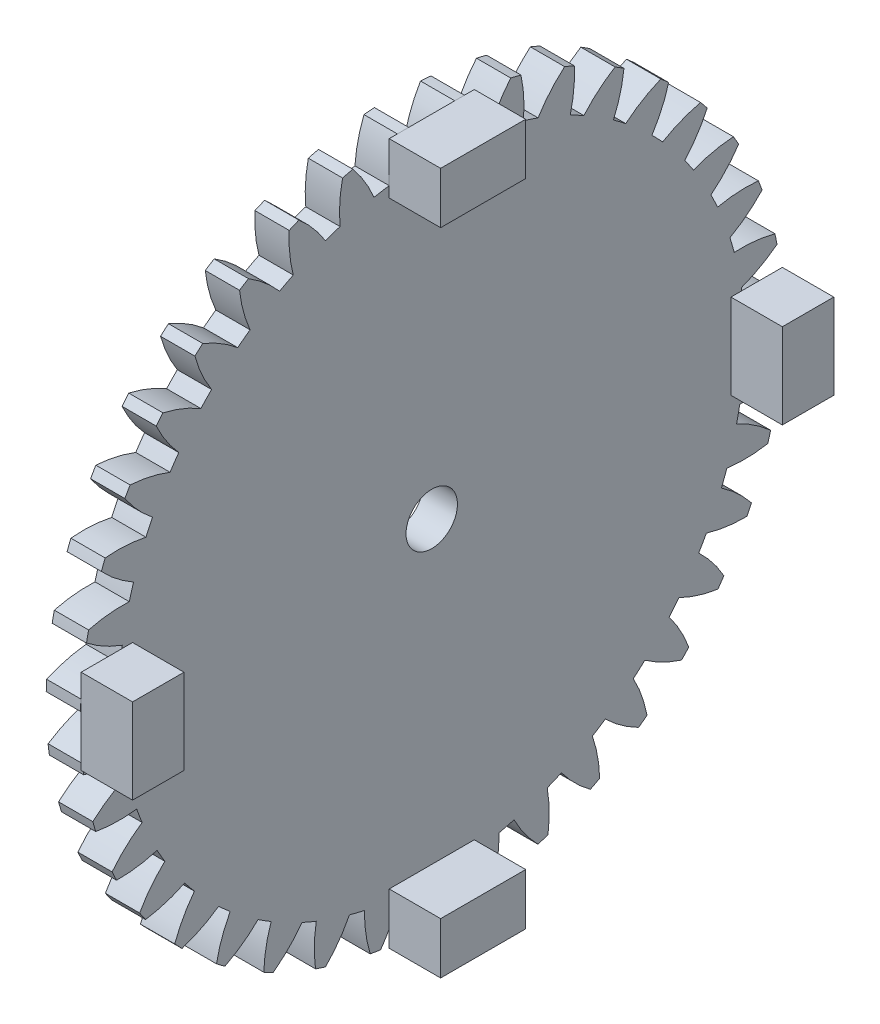
from build123d import *

# Parameters (mm, degrees)
BASPROSKE_W             = 2
BASPROSKE_H             = 20.5
TOOTHCUT_DEPTH          = 30.060282173
TEETHCUTS_COUNT         = 39
TEETHCUTS_ANGLE         = 350.769230769
BORSKE_R                = 1.5
BORE_DEPTH              = 50.0000508
CROQUIS1_W              = 3
CROQUIS1_H              = 4.964439366
CROQUIS1_W_2            = 4.964439366
CROQUIS1_H_2            = 3
SALIENTE_EXTRUIR1_DEPTH = 3


with BuildPart() as part:
    # BasProSke → Base-Revolve (revolve)
    with BuildSketch(Plane(origin=(0, 0, 0), x_dir=(1, 0, 0), z_dir=(0, 1, 0)), mode=Mode.PRIVATE) as base_revolve_sk:
        with Locations((1, 10.25)):
            Rectangle(BASPROSKE_W, BASPROSKE_H)
    revolve(base_revolve_sk.sketch.rotate(Axis((-10, 0, 0), (1, 0, 0)), 180), axis=Axis((-10, 0, 0), (1, 0, 0)))

    # TooCutSke → ToothCut (cut, through all)
    with BuildSketch(Plane(origin=(0, 0, 0), x_dir=(0, 0, -1), z_dir=(1, 0, 0))):
        with BuildLine():
            ThreePointArc((0.450063598, 18.243449338), (0, 18.249), (-0.450063598, 18.243449338))
            ThreePointArc((-0.450063598, 18.243449338), (-0.816963734, 19.397278425), (-1.358007102, 20.480426311))
            ThreePointArc((-1.358007102, 20.480426311), (0, 20.5254), (1.358007102, 20.480426311))
            ThreePointArc((1.358007102, 20.480426311), (0.816963734, 19.397278425), (0.450063598, 18.243449338))
        make_face()
    toothcut = extrude(amount=TOOTHCUT_DEPTH, mode=Mode.SUBTRACT)

    # TeethCuts: ToothCut ×39 about axis
    teethcuts_axis = Axis((-10, 0, 0), (1, 0, 0))
    for i in range(1, TEETHCUTS_COUNT):
        add(toothcut.rotate(teethcuts_axis, i * TEETHCUTS_ANGLE / (TEETHCUTS_COUNT - 1)), mode=Mode.SUBTRACT)

    # BorSke → Bore (cut, symmetric)
    with BuildSketch(Plane(origin=(0, 0, 0), x_dir=(0, 0, -1), z_dir=(1, 0, 0))):
        with Locations(Location((0, 0, 0), (0, 0, 180))):
            Circle(BORSKE_R)
    extrude(amount=BORE_DEPTH, both=True, mode=Mode.SUBTRACT)

    # Croquis1 → Saliente-Extruir1 (add)
    with BuildSketch(Plane(origin=(2, 0, 0), x_dir=(0, 0, -1), z_dir=(1, 0, 0))):
        with Locations((18.955937795, 0)):
            Rectangle(CROQUIS1_W, CROQUIS1_H)
        with Locations((0, 18.955937795)):
            Rectangle(CROQUIS1_W_2, CROQUIS1_H_2)
        with Locations((0, -18.955937795)):
            Rectangle(CROQUIS1_W_2, CROQUIS1_H_2)
        with Locations((-18.955937795, 0)):
            Rectangle(CROQUIS1_W, CROQUIS1_H)
    extrude(amount=SALIENTE_EXTRUIR1_DEPTH)


solid = part.part
